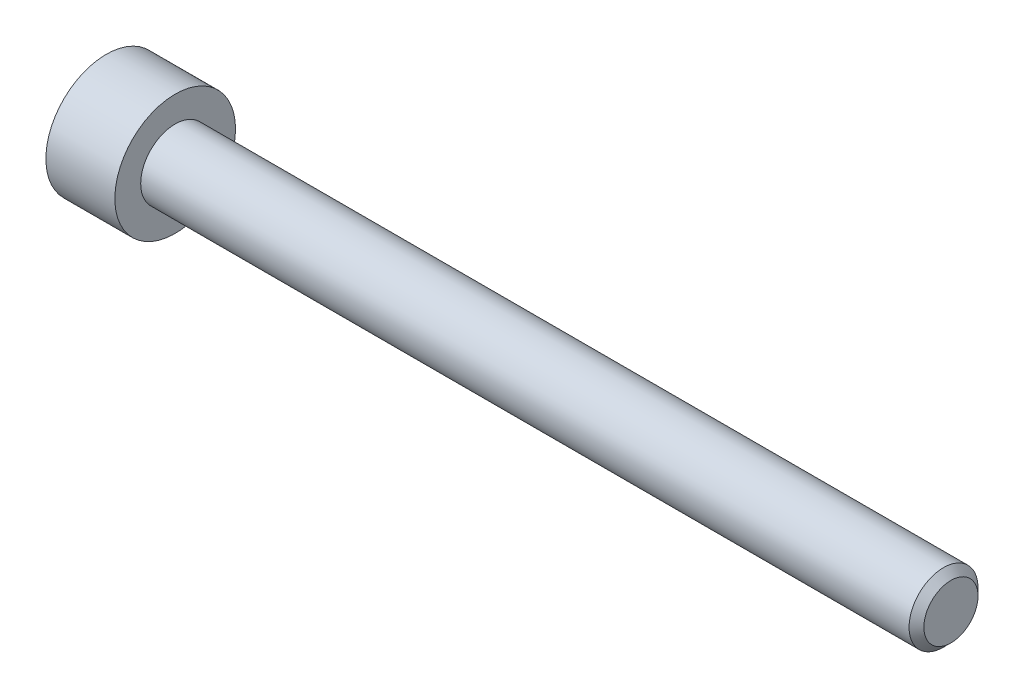
from build123d import *

# Parameters (mm, degrees)
SKETCH1_W           = 4
SKETCH1_H           = 3.5
SKETCH2_R           = 2
BOSS_EXTRUDE1_DEPTH = 45
CUT_EXTRUDE1_DEPTH  = 2
CHAMFER1_SIZE       = 0.4295


with BuildPart() as part:
    # Sketch1 → Revolve1 (revolve)
    with BuildSketch(Plane.XY, mode=Mode.PRIVATE) as revolve1_sk:
        with Locations((-2, 1.75)):
            Rectangle(SKETCH1_W, SKETCH1_H)
    revolve(revolve1_sk.sketch.rotate(Axis((-4, 0, 0), (1, 0, 0)), 270), axis=Axis((-4, 0, 0), (1, 0, 0)))

    # Sketch2 → Boss-Extrude1 (add)
    with BuildSketch(Plane(origin=(0, 0, 0), x_dir=(0, 0, -1), z_dir=(1, 0, 0))):
        with Locations(Location((0, 0, 0), (0, 0, 180))):
            Circle(SKETCH2_R)
    extrude(amount=BOSS_EXTRUDE1_DEPTH)

    # Sketch3 → Cut-Extrude1 (cut)
    with BuildSketch(Plane.ZY.offset(4)):
        Polygon((1.5, -0.866025404), (1.5, 0.866025404), (0, 1.732050808), (-1.5, 0.866025404), (-1.5, -0.866025404), (0, -1.732050808), align=None)
    extrude(amount=-CUT_EXTRUDE1_DEPTH, mode=Mode.SUBTRACT)

    # Sketch4 → Cut-Revolve1 (revolve, cut)
    with BuildSketch(Plane.XY, mode=Mode.PRIVATE) as cut_revolve1_sk:
        Polygon((-2, 1.5), (-2, 0), (-1.598076211, 0), align=None)
    revolve(cut_revolve1_sk.sketch.rotate(Axis((-2.000025, 0, 0), (1, 0, 0)), 90), axis=Axis((-2.000025, 0, 0), (1, 0, 0)), mode=Mode.SUBTRACT)

    # Chamfer1
    chamfer1_edges = [part.edges().sort_by_distance(p)[0] for p in [
        (45, 0, -2),
    ]]
    chamfer(chamfer1_edges, length=CHAMFER1_SIZE)


solid = part.part
